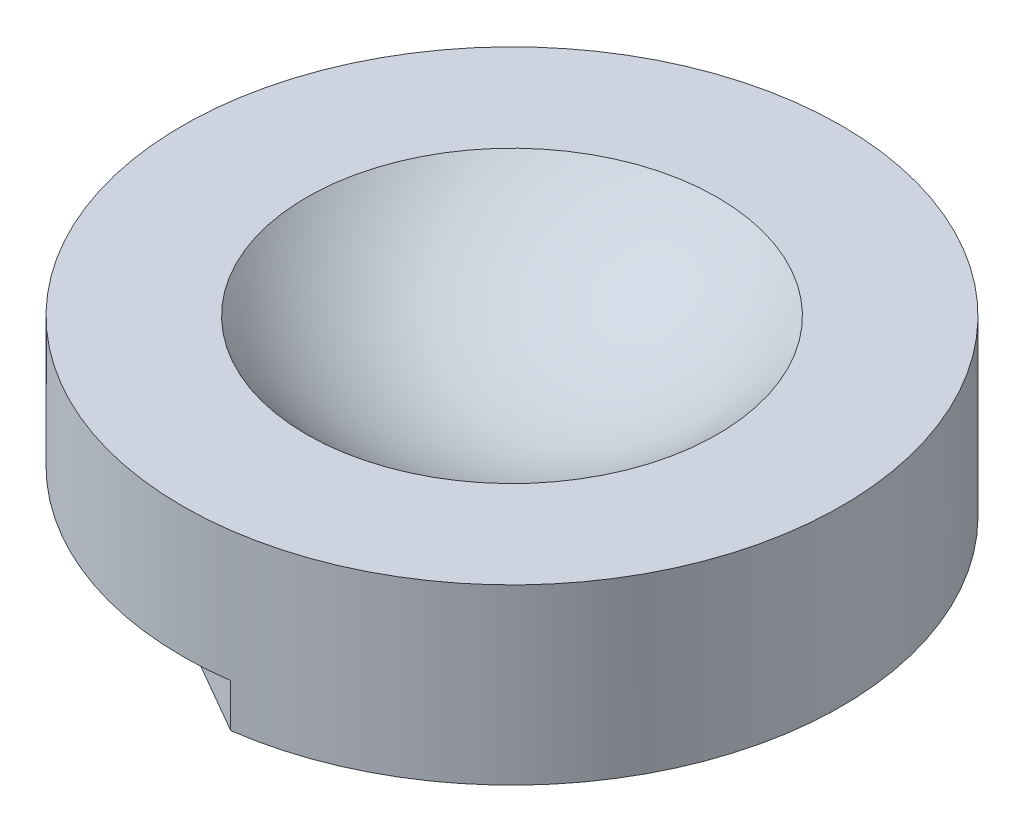
from build123d import *

# Parameters (mm, degrees)
KEYED_BACK_DEPTH   = 0.5
CUP_BLANK_SKETCH_R = 3.8
CUP_BLANK_DEPTH    = 1.5


with BuildPart() as part:
    # Keyed Back Sketch → Keyed Back (new body)
    with BuildSketch(Plane(origin=(0, -69, 0), x_dir=(-1, 0, 0), z_dir=(0, -1, 0))):
        with BuildLine():
            Line((70.771750258, -29.745028704), (74.811552234, -27.412647946))
            ThreePointArc((74.811552234, -27.412647946), (69.391651246, -22.689865579), (70.771750258, -29.745028704))
        make_face()
    extrude(amount=KEYED_BACK_DEPTH)

    # Cup Blank Sketch → Cup Blank (add)
    with BuildSketch(Plane(origin=(0, -69.5, 0), x_dir=(-1, 0, 0), z_dir=(0, -1, 0))):
        with Locations(Location((71.291651246, -25.980762114, 0), (0, 0, 262.136353638))):
            Circle(CUP_BLANK_SKETCH_R)
    extrude(amount=CUP_BLANK_DEPTH)

    # Spherical Bearing Seat profile → Spherical Bearing Seat (revolve, cut)
    with BuildSketch(Plane(origin=(0, -73, 0), x_dir=(-1, 0, 0), z_dir=(0, -1, 0))):
        with BuildLine():
            Line((71.291651246, -29.080762114), (71.291651246, -22.880762114))
            ThreePointArc((71.291651246, -22.880762114), (68.191651246, -25.980762114), (71.291651246, -29.080762114))
        make_face()
    revolve(axis=Axis((-71.291651246, -73, 15.980762114), (0, 0, 1)), mode=Mode.SUBTRACT)


with BuildPart() as body_2:
    # Mirror1: mirrored copy
    add(part.part.mirror(Plane(origin=(0, 0, 0), x_dir=(0, 0, 1), z_dir=(0, -1, 0))))


solid = body_2.part
